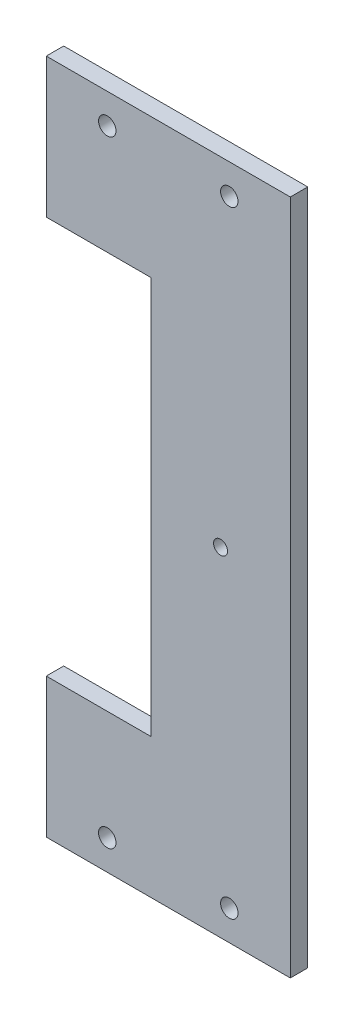
from build123d import *

# Parameters (mm, degrees)
SKETCH1_R           = 2
SKETCH1_R_2         = 2.5
BOSS_EXTRUDE1_DEPTH = 5


with BuildPart() as part:
    # Sketch1 → Boss-Extrude1 (new body)
    with BuildSketch(Plane.XY):
        Polygon((-24.218289086, 78.115044248), (-24.218289086, 38.115044248), (5.781710914, 38.115044248), (5.781710914, -75.884955752), (-24.218289086, -75.884955752), (-24.218289086, -115.884955752), (45.781710914, -115.884955752), (45.781710914, 78.115044248), align=None)
        with Locations((25.781710914, -18.884955752)):
            Circle(SKETCH1_R, mode=Mode.SUBTRACT)
        with Locations((-6.718289086, -107.285805209)):
            Circle(SKETCH1_R_2, mode=Mode.SUBTRACT)
        with Locations(Location((28.281710914, -107.285805209, 0), (0, 0, 180))):
            Circle(SKETCH1_R_2, mode=Mode.SUBTRACT)
        with Locations((28.281710914, 69.515893704)):
            Circle(SKETCH1_R_2, mode=Mode.SUBTRACT)
        with Locations(Location((-6.718289086, 69.515893704, 0), (0, 0, 180))):
            Circle(SKETCH1_R_2, mode=Mode.SUBTRACT)
    extrude(amount=BOSS_EXTRUDE1_DEPTH)


solid = part.part
